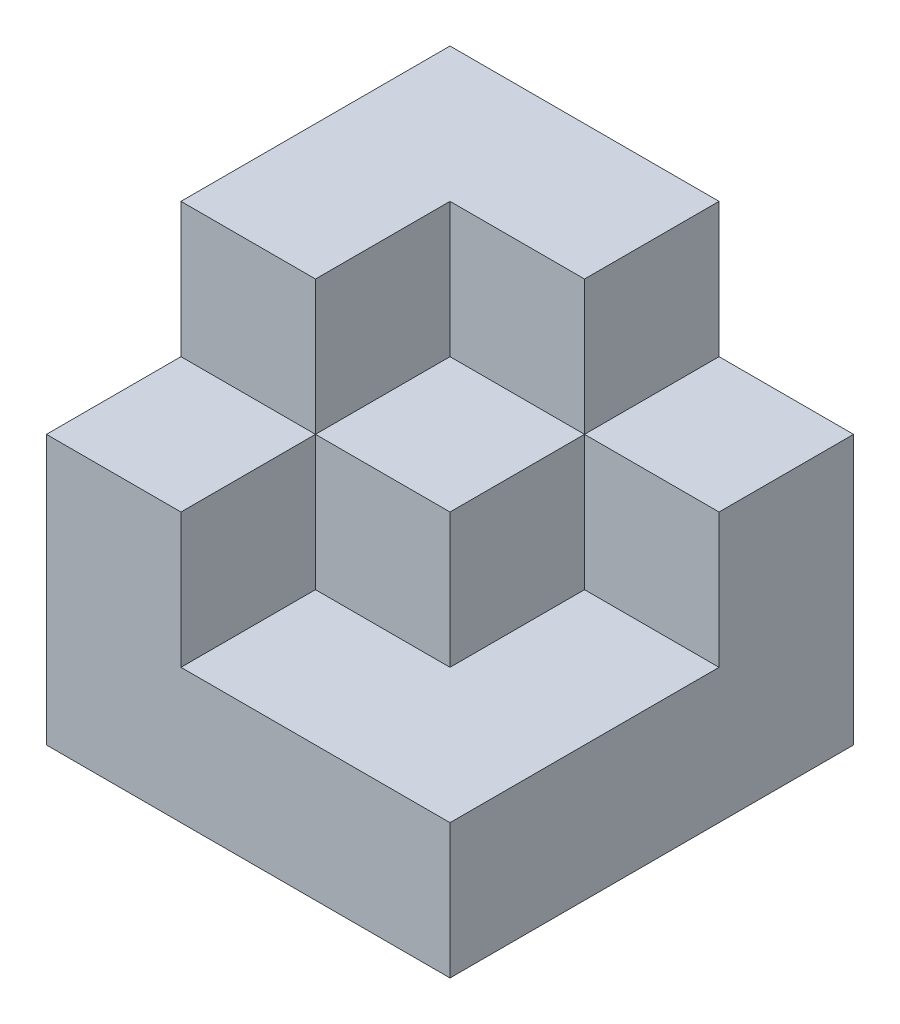
from build123d import *

# Parameters (mm, degrees)
CROQUIS1_W              = 60
CROQUIS1_H              = 60
SALIENTE_EXTRUIR1_DEPTH = 20
CROQUIS2_W              = 20
CROQUIS2_H              = 20
SALIENTE_EXTRUIR2_DEPTH = 20
CROQUIS3_W              = 20
CROQUIS3_H              = 20
SALIENTE_EXTRUIR4_DEPTH = 40
CROQUIS4_W              = 40
CROQUIS4_H              = 20
SALIENTE_EXTRUIR5_DEPTH = 40
CROQUIS5_W              = 20
CROQUIS5_H              = 20
SALIENTE_EXTRUIR6_DEPTH = 20
CROQUIS6_W              = 20
CROQUIS6_H              = 20
SALIENTE_EXTRUIR7_DEPTH = 20


with BuildPart() as part:
    # Croquis1 → Saliente-Extruir1 (new body)
    with BuildSketch(Plane(origin=(0, 0, 0), x_dir=(1, 0, 0), z_dir=(0, 1, 0))):
        Rectangle(CROQUIS1_W, CROQUIS1_H)
    extrude(amount=SALIENTE_EXTRUIR1_DEPTH)

    # Croquis2 → Saliente-Extruir2 (add)
    with BuildSketch(Plane(origin=(0, 20, 0), x_dir=(1, 0, 0), z_dir=(0, 1, 0))):
        with Locations((-20, -20)):
            Rectangle(CROQUIS2_W, CROQUIS2_H)
    extrude(amount=SALIENTE_EXTRUIR2_DEPTH)

    # Croquis3 → Saliente-Extruir4 (add)
    with BuildSketch(Plane(origin=(0, 20, 0), x_dir=(1, 0, 0), z_dir=(0, 1, 0))):
        with Locations((-20, 0)):
            Rectangle(CROQUIS3_W, CROQUIS3_H)
    extrude(amount=SALIENTE_EXTRUIR4_DEPTH)

    # Croquis4 → Saliente-Extruir5 (add)
    with BuildSketch(Plane(origin=(0, 20, 0), x_dir=(1, 0, 0), z_dir=(0, 1, 0))):
        with Locations((-10, 20)):
            Rectangle(CROQUIS4_W, CROQUIS4_H)
    extrude(amount=SALIENTE_EXTRUIR5_DEPTH)

    # Croquis5 → Saliente-Extruir6 (add)
    with BuildSketch(Plane(origin=(0, 20, 0), x_dir=(1, 0, 0), z_dir=(0, 1, 0))):
        with Locations((20, 20)):
            Rectangle(CROQUIS5_W, CROQUIS5_H)
    extrude(amount=SALIENTE_EXTRUIR6_DEPTH)

    # Croquis6 → Saliente-Extruir7 (add)
    with BuildSketch(Plane(origin=(0, 20, 0), x_dir=(1, 0, 0), z_dir=(0, 1, 0))):
        Rectangle(CROQUIS6_W, CROQUIS6_H)
    extrude(amount=SALIENTE_EXTRUIR7_DEPTH)


solid = part.part
